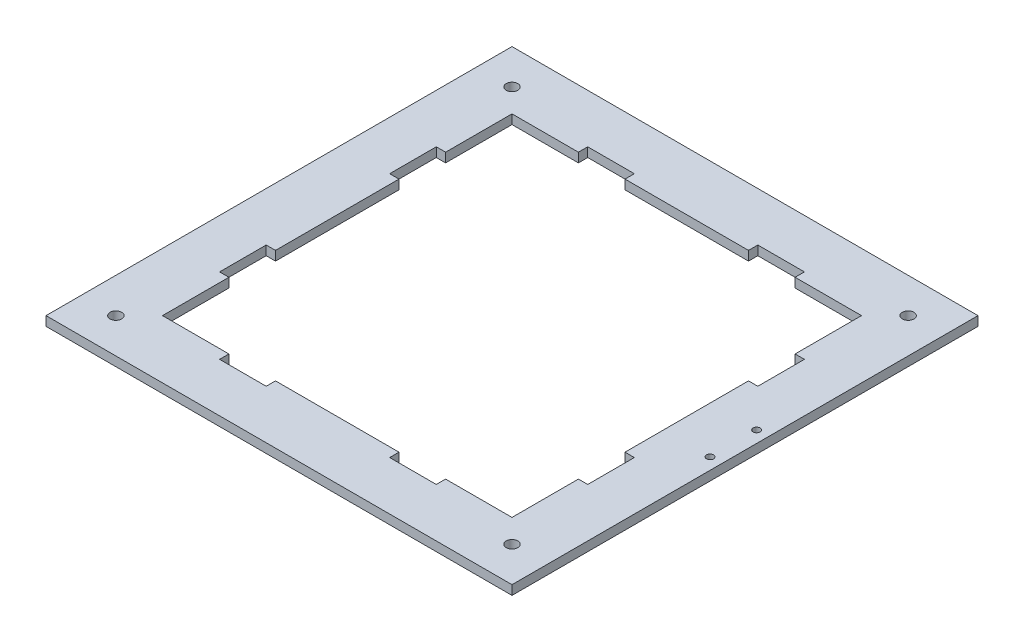
from build123d import *

# Parameters (mm, degrees)
CROQUIS1_W              = 200
CROQUIS1_H              = 200
CROQUIS1_R              = 2.5
SALIENTE_EXTRUIR1_DEPTH = 4
CROQUIS2_W              = 150
CROQUIS2_H              = 150
CROQUIS2_W_2            = 4
CROQUIS2_H_2            = 20
CROQUIS2_W_3            = 20
CROQUIS2_H_3            = 4
CORTAR_EXTRUIR1_DEPTH   = 4
CROQUIS3_R              = 1.5
CORTAR_EXTRUIR2_DEPTH   = 10


with BuildPart() as part:
    # Croquis1 → Saliente-Extruir1 (new body)
    with BuildSketch(Plane(origin=(0, 0, 0), x_dir=(1, 0, 0), z_dir=(0, 1, 0))):
        with Locations((100, 100)):
            Rectangle(CROQUIS1_W, CROQUIS1_H)
        with Locations(Location((15, 185, 0), (0, 0, 270))):
            Circle(CROQUIS1_R, mode=Mode.SUBTRACT)
        with Locations(Location((185, 185, 0), (0, 0, 270))):
            Circle(CROQUIS1_R, mode=Mode.SUBTRACT)
        with Locations(Location((185, 15, 0), (0, 0, 270))):
            Circle(CROQUIS1_R, mode=Mode.SUBTRACT)
        with Locations(Location((15, 15, 0), (0, 0, 270))):
            Circle(CROQUIS1_R, mode=Mode.SUBTRACT)
    extrude(amount=SALIENTE_EXTRUIR1_DEPTH)

    # Croquis2 → Cortar-Extruir1 (cut)
    with BuildSketch(Plane(origin=(0, 4, 0), x_dir=(1, 0, 0), z_dir=(0, 1, 0))):
        with Locations((100, 100)):
            Rectangle(CROQUIS2_W, CROQUIS2_H)
        with Locations((23, 136.5)):
            Rectangle(CROQUIS2_W_2, CROQUIS2_H_2)
        with Locations((63.5, 177)):
            Rectangle(CROQUIS2_W_3, CROQUIS2_H_3)
        with Locations((177, 136.5)):
            Rectangle(CROQUIS2_W_2, CROQUIS2_H_2)
        with Locations((136.5, 177)):
            Rectangle(CROQUIS2_W_3, CROQUIS2_H_3)
        with Locations((136.5, 23)):
            Rectangle(CROQUIS2_W_3, CROQUIS2_H_3)
        with Locations((177, 63.5)):
            Rectangle(CROQUIS2_W_2, CROQUIS2_H_2)
        with Locations((23, 63.5)):
            Rectangle(CROQUIS2_W_2, CROQUIS2_H_2)
        with Locations((63.5, 23)):
            Rectangle(CROQUIS2_W_3, CROQUIS2_H_3)
    extrude(amount=-CORTAR_EXTRUIR1_DEPTH, mode=Mode.SUBTRACT)

    # Croquis3 → Cortar-Extruir2 (cut)
    with BuildSketch(Plane(origin=(0, 4, 0), x_dir=(1, 0, 0), z_dir=(0, 1, 0))):
        with Locations(Location((195, 110, 0), (0, 0, 270))):
            Circle(CROQUIS3_R)
        with Locations(Location((195, 90, 0), (0, 0, 270))):
            Circle(CROQUIS3_R)
    extrude(amount=-CORTAR_EXTRUIR2_DEPTH, mode=Mode.SUBTRACT)


solid = part.part
